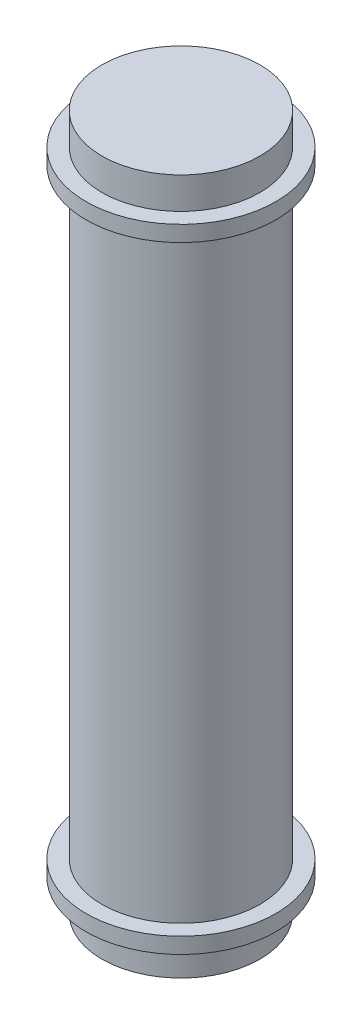
from build123d import *

# Parameters (mm, degrees)
CROQUIS1_R              = 0.5
SALIENTE_EXTRUIR1_DEPTH = 4.4
SALIENTE_EXTRUIR2_START = -0.2
CROQUIS2_R              = 0.6
SALIENTE_EXTRUIR2_DEPTH = 0.1


with BuildPart() as part:
    # Croquis1 → Saliente-Extruir1 (new body)
    with BuildSketch(Plane(origin=(0, 0, 0), x_dir=(1, 0, 0), z_dir=(0, 1, 0))):
        with Locations(Location((0, 0, 0), (0, 0, 270))):
            Circle(CROQUIS1_R)
    extrude(amount=SALIENTE_EXTRUIR1_DEPTH)

    # Croquis2 → Saliente-Extruir2 (add)
    with BuildSketch(Plane.XZ.offset(SALIENTE_EXTRUIR2_START)):
        with Locations(Location((0, 0, 0), (0, 0, 270))):
            Circle(CROQUIS2_R)
    saliente_extruir2 = extrude(amount=-SALIENTE_EXTRUIR2_DEPTH)

    # Simetría1: Saliente-Extruir2 across plane
    add(saliente_extruir2.mirror(Plane(origin=(0, 2.2, 0), x_dir=(0, 0, 1), z_dir=(0, -1, 0))))


solid = part.part
